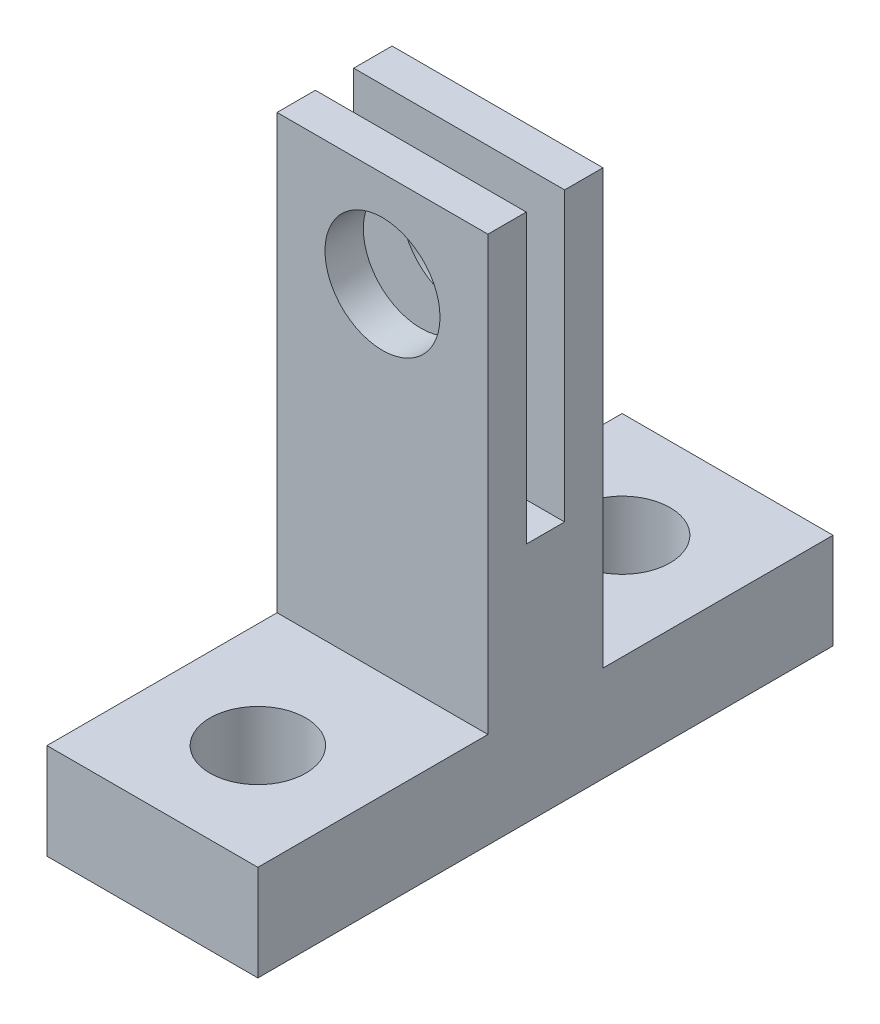
from build123d import *

# Parameters (mm, degrees)
BOSS_EXTRUDE1_DEPTH     = 2.75
SKETCH2_R               = 1.25
CUT_EXTRUDE1_DEPTH      = 14.838442831
CUT_EXTRUDE2_DEPTH      = 11.9573035
CUT_EXTRUDE2_DEPTH_BACK = 11.9573035
SKETCH4_R               = 1.5


with BuildPart() as part:
    # Sketch1 → Boss-Extrude1 (new, symmetric)
    with BuildSketch(Plane(origin=(0, 0, 0), x_dir=(0, 0, -1), z_dir=(1, 0, 0))):
        Polygon((-0.5, 7.5), (-0.5, 0), (0.5, 0), (0.5, 7.5), (1.5, 7.5), (1.5, -3.8), (7.5, -3.8), (7.5, -6.3), (-7.5, -6.3), (-7.5, -3.8), (-1.5, -3.8), (-1.5, 7.5), align=None)
    extrude(amount=BOSS_EXTRUDE1_DEPTH, both=True)

    # Sketch2 → Cut-Extrude1 (cut, through all)
    with BuildSketch(Plane(origin=(0, -3.8, 0), x_dir=(1, 0, 0), z_dir=(0, 1, 0))):
        with Locations(Location((0, -4.75, 0), (0, 0, 270))):
            Circle(SKETCH2_R)
        with Locations(Location((0, 4.75, 0), (0, 0, 90))):
            Circle(SKETCH2_R)
    extrude(amount=-CUT_EXTRUDE1_DEPTH, mode=Mode.SUBTRACT)

    # Sketch4 → Cut-Extrude2 (cut, two sides: drawn at the far end of the back side and taken through both)
    with BuildSketch(Plane.XY.offset(-CUT_EXTRUDE2_DEPTH_BACK)):
        with Locations(Location((0, 5, 0), (0, 0, 270))):
            Circle(SKETCH4_R)
    extrude(amount=CUT_EXTRUDE2_DEPTH + CUT_EXTRUDE2_DEPTH_BACK, mode=Mode.SUBTRACT)


solid = part.part
